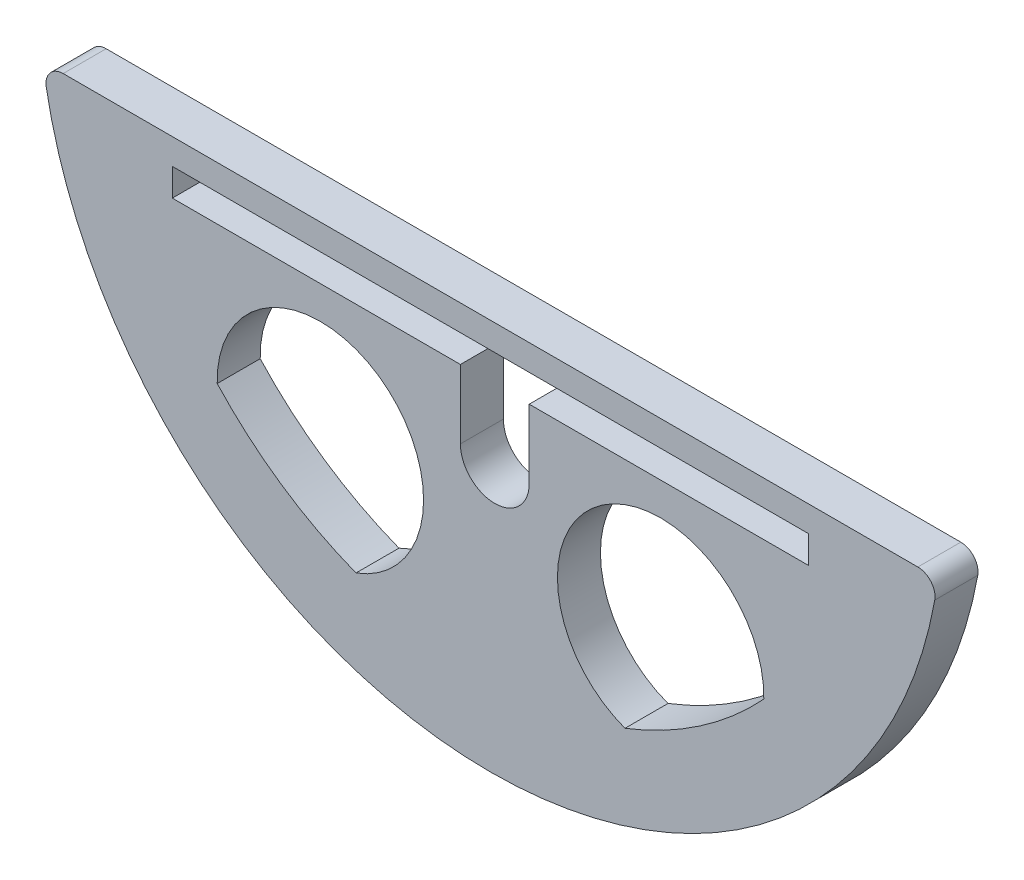
from build123d import *

# Parameters (mm, degrees)
SALIENTE_EXTRUIR1_DEPTH = 5
SALIENTE_EXTRUIR2_DEPTH = 5


with BuildPart() as part:
    # Croquis1 → Saliente-Extruir1 (new body)
    with BuildSketch(Plane.XY):
        with BuildLine():
            ThreePointArc((-51.659530699, 2.243564356), (0, -40.9), (51.659530699, 2.243564356))
            ThreePointArc((51.659530699, 2.243564356), (51.226617189, 3.88201574), (49.691548577, 4.6))
            Line((49.691548577, 4.6), (-49.691548577, 4.6))
            ThreePointArc((-49.691548577, 4.6), (-51.226617189, 3.88201574), (-51.659530699, 2.243564356))
        make_face()
        with BuildLine():
            ThreePointArc((-3.5, -31.457984161), (-25.58189602, -23.211012568), (-40.04747183, -4.6))
            Line((-40.04747183, -4.6), (-5.5, -4.6))
            Line((-5.5, -4.6), (-5.5, -9.6))
            ThreePointArc((-5.5, -9.6), (-4.977225575, -12.049489743), (-3.5, -14.072135955))
            Line((-3.5, -14.072135955), (-3.5, -31.457984161))
        make_face(mode=Mode.SUBTRACT)
        with BuildLine():
            ThreePointArc((40.04747183, -4.6), (25.984811469, -22.911296309), (4.5, -31.364985744))
            Line((4.5, -31.364985744), (4.5, -14.072135955))
            ThreePointArc((4.5, -14.072135955), (5.977225575, -12.049489743), (6.5, -9.6))
            Line((6.5, -9.6), (6.5, -4.6))
            Line((6.5, -4.6), (40.04747183, -4.6))
        make_face(mode=Mode.SUBTRACT)
        with BuildLine():
            Line((-3.5, -1.6), (-37, -1.6))
            Line((-37, -1.6), (-37, 1.6))
            Line((-37, 1.6), (37, 1.6))
            Line((37, 1.6), (37, -1.6))
            Line((37, -1.6), (4.5, -1.6))
            Line((4.5, -1.6), (4.5, -9.6))
            ThreePointArc((4.5, -9.6), (0.5, -13.6), (-3.5, -9.6))
            Line((-3.5, -9.6), (-3.5, -1.6))
        make_face(mode=Mode.SUBTRACT)
    extrude(amount=SALIENTE_EXTRUIR1_DEPTH)

    # Croquis3 → Saliente-Extruir2 (add)
    with BuildSketch(Plane.XY):
        with BuildLine():
            Line((40.04747183, -4.6), (6.5, -4.6))
            Line((6.5, -4.6), (6.5, -9.6))
            ThreePointArc((6.5, -9.6), (5.977225575, -12.049489743), (4.5, -14.072135955))
            Line((4.5, -14.072135955), (4.5, -31.364985744))
            ThreePointArc((4.5, -31.364985744), (10.160094866, -30.388242072), (15.640583324, -28.66924575))
            ThreePointArc((15.640583324, -28.66924575), (13.021749092, -7.49311258), (31.780404624, -17.661679411))
            ThreePointArc((31.780404624, -17.661679411), (36.502915311, -11.503618196), (40.04747183, -4.6))
        make_face()
        with BuildLine():
            Line((-3.5, -31.457984161), (-3.5, -14.072135955))
            ThreePointArc((-3.5, -14.072135955), (-4.977225575, -12.049489743), (-5.5, -9.6))
            Line((-5.5, -9.6), (-5.5, -4.6))
            Line((-5.5, -4.6), (-40.04747183, -4.6))
            ThreePointArc((-40.04747183, -4.6), (-36.502915311, -11.503618196), (-31.780404624, -17.661679411))
            ThreePointArc((-31.780404624, -17.661679411), (-13.021749092, -7.49311258), (-15.640583324, -28.66924575))
            ThreePointArc((-15.640583324, -28.66924575), (-9.671336411, -30.50350641), (-3.5, -31.457984161))
        make_face()
    extrude(amount=SALIENTE_EXTRUIR2_DEPTH)


solid = part.part
